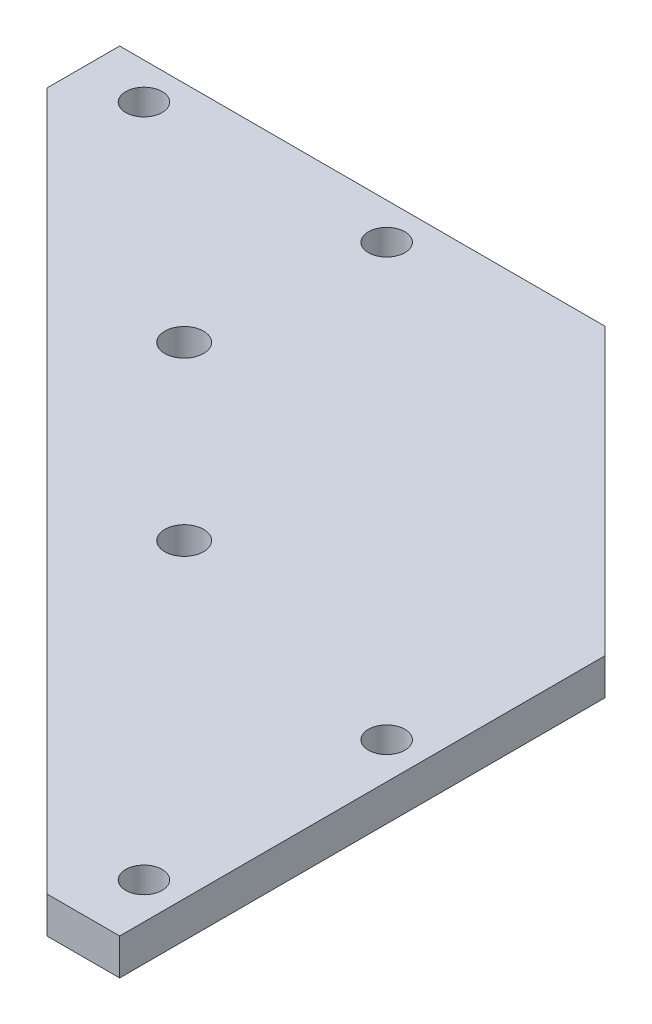
from build123d import *

# Parameters (mm, degrees)
SKETCH_1_R          = 1.5
EXTRUDE_1_DEPTH     = 3
SKETCH_2_R          = 1.6
CUT_EXTRUDE_1_DEPTH = 10


with BuildPart() as part:
    # 草图1 → 凸台-拉伸1 (new body)
    with BuildSketch(Plane(origin=(0, 0, 0), x_dir=(1, 0, 0), z_dir=(0, 1, 0))):
        Polygon((0, 0), (-40, 0), (-40, -6), (17.5, -63.5), (23.5, -63.5), (23.5, -23.5), align=None)
        with Locations(Location((-35, -3, 0), (0, 0, 270))):
            Circle(SKETCH_1_R, mode=Mode.SUBTRACT)
        with Locations(Location((-15, -3, 0), (0, 0, 270))):
            Circle(SKETCH_1_R, mode=Mode.SUBTRACT)
        with Locations(Location((20.5, -58.5, 0), (0, 0, 90))):
            Circle(SKETCH_1_R, mode=Mode.SUBTRACT)
        with Locations(Location((20.5, -38.5, 0), (0, 0, 90))):
            Circle(SKETCH_1_R, mode=Mode.SUBTRACT)
    extrude(amount=EXTRUDE_1_DEPTH)

    # 草图2 → 切除-拉伸1 (cut)
    with BuildSketch(Plane(origin=(0, 3, 0), x_dir=(1, 0, 0), z_dir=(0, 1, 0))):
        with Locations(Location((-16.199747468, -18.486544033, 0), (0, 0, 270))):
            Circle(SKETCH_2_R)
        with Locations(Location((-2.057611845, -32.628679656, 0), (0, 0, 270))):
            Circle(SKETCH_2_R)
    extrude(amount=-CUT_EXTRUDE_1_DEPTH, mode=Mode.SUBTRACT)


solid = part.part
